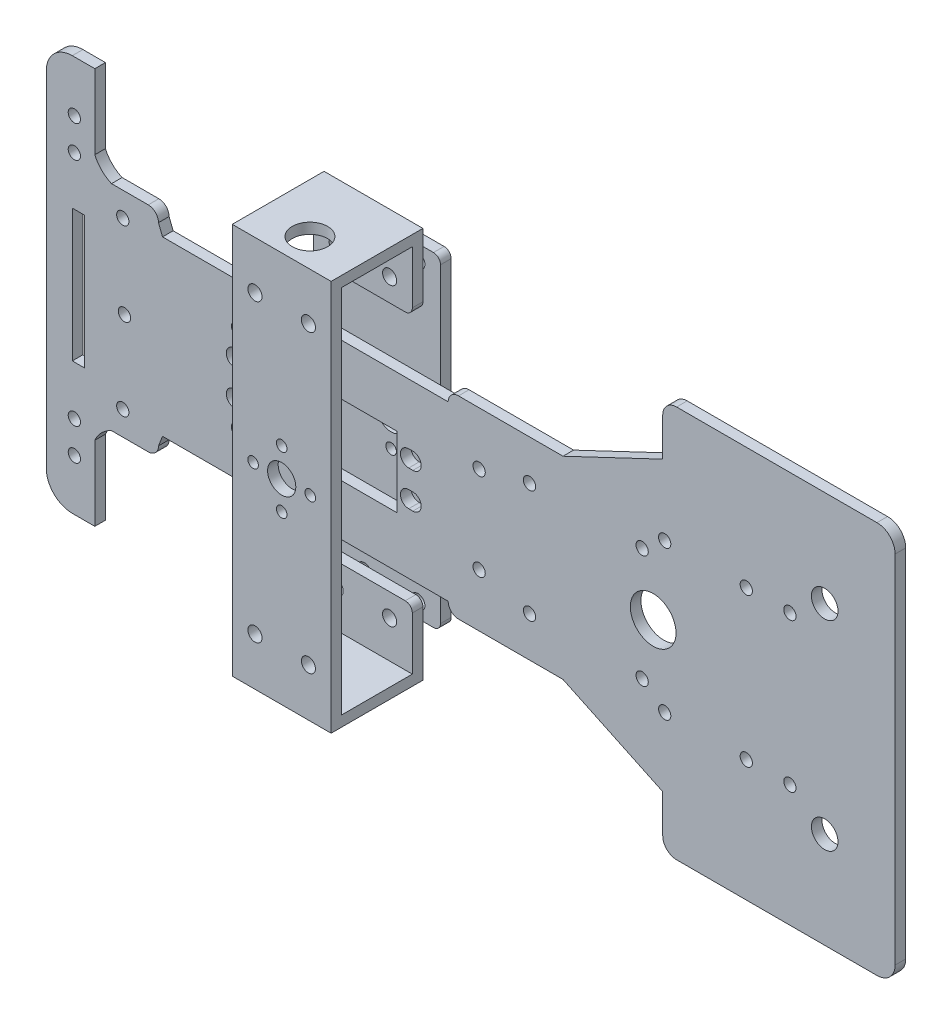
from build123d import *

# Parameters (mm, degrees)
CROQUIS2_R              = 1.737
CROQUIS2_R_2            = 6.474679508
CROQUIS2_R_3            = 1.75
CROQUIS2_R_4            = 3.766613255
CROQUIS2_W              = 3.410440409
CROQUIS2_H              = 37.484878613
SALIENTE_EXTRUIR1_DEPTH = 3
CROQUIS5_W              = 28
CROQUIS5_H              = 110.848883777
CROQUIS5_R              = 2
CROQUIS5_R_2            = 1.5
CROQUIS5_R_3            = 4
SALIENTE_EXTRUIR2_DEPTH = 3
CROQUIS8_W              = 28
CROQUIS8_H              = 3
SALIENTE_EXTRUIR3_DEPTH = 20
CROQUIS9_W              = 28
CROQUIS9_H              = 20
CROQUIS9_R              = 2
SALIENTE_EXTRUIR4_DEPTH = 3
CROQUIS11_W             = 28
CROQUIS11_H             = 92
CROQUIS11_R             = 2
CROQUIS11_R_2           = 4
CROQUIS11_R_3           = 1.5
SALIENTE_EXTRUIR5_DEPTH = 3
REDONDEO1_R             = 2
REDONDEO2_R             = 2
CROQUIS14_R             = 5
CORTAR_EXTRUIR1_DEPTH   = 143


with BuildPart() as part:
    # Croquis2 → Saliente-Extruir1 (new body)
    with BuildSketch(Plane.XY):
        with BuildLine():
            Line((135.637006617, 140.883623312), (142.01615233, 140.883623312))
            Line((142.01615233, 140.883623312), (142.01615233, 162.000573595))
            ThreePointArc((142.01615233, 162.000573595), (143.931876639, 164.810273756), (146.7415768, 166.725998065))
            Line((146.7415768, 166.725998065), (157.149961252, 166.725998065))
            ThreePointArc((157.149961252, 166.725998065), (159.207212475, 167.582059418), (160.049881153, 169.644832585))
            Line((160.049881153, 169.644832585), (161.200256838, 172.563544535))
            Line((161.200256838, 172.563544535), (242.107132368, 172.563544535))
            ThreePointArc((242.107132368, 172.563544535), (242.962021256, 170.499660188), (245.025905603, 169.6447713))
            Line((245.025905603, 169.6447713), (274.636700881, 169.6447713))
            Line((274.636700881, 169.6447713), (302.883038873, 156.245715556))
            Line((302.883038873, 156.245715556), (302.883038873, 145.415373876))
            ThreePointArc((302.883038873, 145.415373876), (304.035024246, 142.634235165), (306.816162957, 141.482249792))
            Line((306.816162957, 141.482249792), (363.555254762, 141.482249792))
            ThreePointArc((363.555254762, 141.482249792), (367.198292756, 142.9693816), (368.710342921, 146.602147921))
            Line((368.710342921, 146.602147921), (368.710342921, 247.445499159))
            ThreePointArc((368.710342921, 247.445499159), (367.198292756, 251.07826548), (363.555254762, 252.565397288))
            Line((363.555254762, 252.565397288), (306.816162957, 252.565397288))
            ThreePointArc((306.816162957, 252.565397288), (304.035024246, 251.413411916), (302.883038873, 248.632273205))
            Line((302.883038873, 248.632273205), (302.883038873, 237.801931524))
            Line((302.883038873, 237.801931524), (274.636700881, 224.402875781))
            Line((274.636700881, 224.402875781), (245.025905603, 224.402875781))
            ThreePointArc((245.025905603, 224.402875781), (242.962021256, 223.547986893), (242.107132368, 221.484102546))
            Line((242.107132368, 221.484102546), (161.200256838, 221.484102546))
            Line((161.200256838, 221.484102546), (160.049881153, 224.402814495))
            ThreePointArc((160.049881153, 224.402814495), (159.207212475, 226.465587662), (157.149961252, 227.321649016))
            Line((157.149961252, 227.321649016), (146.7415768, 227.321649016))
            ThreePointArc((146.7415768, 227.321649016), (143.931876639, 229.237373325), (142.01615233, 232.047073485))
            Line((142.01615233, 232.047073485), (142.01615233, 253.164023769))
            Line((142.01615233, 253.164023769), (135.637006617, 253.164023769))
            ThreePointArc((135.637006617, 253.164023769), (130.426405841, 251.005722259), (128.268104332, 245.795121484))
            Line((128.268104332, 245.795121484), (128.268104332, 148.252525597))
            ThreePointArc((128.268104332, 148.252525597), (130.426405841, 143.041924821), (135.637006617, 140.883623312))
        make_face()
        with Locations((136.215052653, 164.393067533)):
            Circle(CROQUIS2_R, mode=Mode.SUBTRACT)
        with Locations((136.215052653, 155.358437852)):
            Circle(CROQUIS2_R, mode=Mode.SUBTRACT)
        with Locations((149.928329849, 173.589029888)):
            Circle(CROQUIS2_R, mode=Mode.SUBTRACT)
        with Locations((182.434790984, 184.674109598)):
            Circle(CROQUIS2_R, mode=Mode.SUBTRACT)
        with Locations((250.875860992, 184.674109598)):
            Circle(CROQUIS2_R, mode=Mode.SUBTRACT)
        with Locations((265.148676133, 181.032013917)):
            Circle(CROQUIS2_R, mode=Mode.SUBTRACT)
        with Locations((297.051795115, 181.032013917)):
            Circle(CROQUIS2_R, mode=Mode.SUBTRACT)
        with Locations((303.441737448, 175.948286728)):
            Circle(CROQUIS2_R, mode=Mode.SUBTRACT)
        with Locations((326.550008787, 175.948286728)):
            Circle(CROQUIS2_R, mode=Mode.SUBTRACT)
        with Locations((338.901523724, 175.948286728)):
            Circle(CROQUIS2_R, mode=Mode.SUBTRACT)
        with Locations(Location((338.901523724, 218.099360352, 0), (0, 0, 180))):
            Circle(CROQUIS2_R, mode=Mode.SUBTRACT)
        with Locations(Location((326.550008787, 218.099360352, 0), (0, 0, 180))):
            Circle(CROQUIS2_R, mode=Mode.SUBTRACT)
        with Locations(Location((303.441737448, 218.099360352, 0), (0, 0, 180))):
            Circle(CROQUIS2_R, mode=Mode.SUBTRACT)
        with Locations(Location((297.051795115, 213.015633164, 0), (0, 0, 180))):
            Circle(CROQUIS2_R, mode=Mode.SUBTRACT)
        with Locations(Location((265.148676133, 213.015633164, 0), (0, 0, 180))):
            Circle(CROQUIS2_R, mode=Mode.SUBTRACT)
        with Locations(Location((250.875860992, 209.373537482, 0), (0, 0, 180))):
            Circle(CROQUIS2_R, mode=Mode.SUBTRACT)
        with Locations(Location((182.434790984, 209.373537482, 0), (0, 0, 180))):
            Circle(CROQUIS2_R, mode=Mode.SUBTRACT)
        with Locations(Location((149.928329849, 220.458617193, 0), (0, 0, 180))):
            Circle(CROQUIS2_R, mode=Mode.SUBTRACT)
        with Locations(Location((136.215052653, 238.689209229, 0), (0, 0, 180))):
            Circle(CROQUIS2_R, mode=Mode.SUBTRACT)
        with Locations(Location((136.215052653, 229.654579547, 0), (0, 0, 180))):
            Circle(CROQUIS2_R, mode=Mode.SUBTRACT)
        with Locations((300.175367567, 197.02382354)):
            Circle(CROQUIS2_R_2, mode=Mode.SUBTRACT)
        with Locations((150.399844764, 197.02382354)):
            Circle(CROQUIS2_R_3, mode=Mode.SUBTRACT)
        with Locations((348.762469348, 168.738884611)):
            Circle(CROQUIS2_R_4, mode=Mode.SUBTRACT)
        with Locations(Location((348.762469348, 225.30876247, 0), (0, 0, 180))):
            Circle(CROQUIS2_R_4, mode=Mode.SUBTRACT)
        with Locations((137.342226821, 197.023823541)):
            Rectangle(CROQUIS2_W, CROQUIS2_H, mode=Mode.SUBTRACT)
        Polygon((186.108331183, 187.02382354), (186.108331183, 207.02382354), (227.108331183, 207.02382354), (227.608331183, 207.02382354), (227.608331183, 187.02382354), align=None, mode=Mode.SUBTRACT)
        with BuildLine():
            Line((181.608331183, 204.378747893), (182.787568431, 204.378747893))
            ThreePointArc((182.787568431, 204.378747893), (185.142492784, 202.02382354), (182.787568431, 199.668899188))
            Line((182.787568431, 199.668899188), (181.608331183, 199.668899188))
            ThreePointArc((181.608331183, 199.668899188), (179.25340683, 202.02382354), (181.608331183, 204.378747893))
        make_face(mode=Mode.SUBTRACT)
        with BuildLine():
            Line((181.608331183, 189.668899188), (182.787568431, 189.668899188))
            ThreePointArc((182.787568431, 189.668899188), (185.142492784, 192.02382354), (182.787568431, 194.378747893))
            Line((182.787568431, 194.378747893), (181.608331183, 194.378747893))
            ThreePointArc((181.608331183, 194.378747893), (179.25340683, 192.02382354), (181.608331183, 189.668899188))
        make_face(mode=Mode.SUBTRACT)
        with BuildLine():
            Line((232.108331183, 189.668899188), (230.929093935, 189.668899188))
            ThreePointArc((230.929093935, 189.668899188), (228.574169582, 192.02382354), (230.929093935, 194.378747893))
            Line((230.929093935, 194.378747893), (232.108331183, 194.378747893))
            ThreePointArc((232.108331183, 194.378747893), (234.463255535, 192.02382354), (232.108331183, 189.668899188))
        make_face(mode=Mode.SUBTRACT)
        with BuildLine():
            Line((232.108331183, 204.378747893), (230.929093935, 204.378747893))
            ThreePointArc((230.929093935, 204.378747893), (228.574169582, 202.02382354), (230.929093935, 199.668899188))
            Line((230.929093935, 199.668899188), (232.108331183, 199.668899188))
            ThreePointArc((232.108331183, 199.668899188), (234.463255535, 202.02382354), (232.108331183, 204.378747893))
        make_face(mode=Mode.SUBTRACT)
    extrude(amount=SALIENTE_EXTRUIR1_DEPTH)


with BuildPart() as body_2:
    # Croquis5 → Saliente-Extruir2 (new body)
    with BuildSketch(Plane.XY.offset(18)):
        with Locations((212.947987222, 197.023823541)):
            Rectangle(CROQUIS5_W, CROQUIS5_H)
        with Locations((205.377900936, 155.173005863)):
            Circle(CROQUIS5_R, mode=Mode.SUBTRACT)
        with Locations(Location((220.518073507, 155.173005863, 0), (0, 0, 180))):
            Circle(CROQUIS5_R, mode=Mode.SUBTRACT)
        with Locations((220.518073507, 238.874641218)):
            Circle(CROQUIS5_R, mode=Mode.SUBTRACT)
        with Locations(Location((205.377900936, 238.874641218, 0), (0, 0, 180))):
            Circle(CROQUIS5_R, mode=Mode.SUBTRACT)
        with Locations((212.947987222, 205.12382354)):
            Circle(CROQUIS5_R_2, mode=Mode.SUBTRACT)
        with Locations((212.947987222, 188.92382354)):
            Circle(CROQUIS5_R_2, mode=Mode.SUBTRACT)
        with Locations((204.847987222, 197.02382354)):
            Circle(CROQUIS5_R_2, mode=Mode.SUBTRACT)
        with Locations((221.047987222, 197.02382354)):
            Circle(CROQUIS5_R_2, mode=Mode.SUBTRACT)
        with Locations((212.947987222, 197.02382354)):
            Circle(CROQUIS5_R_3, mode=Mode.SUBTRACT)
    extrude(amount=SALIENTE_EXTRUIR2_DEPTH)

    # Croquis8 → Saliente-Extruir3 (add)
    with BuildSketch(Plane(origin=(0, 0, 18), x_dir=(-1, 0, 0), z_dir=(0, 0, -1))):
        with Locations((-212.947987222, 143.099381652)):
            Rectangle(CROQUIS8_W, CROQUIS8_H)
        with Locations((-212.947987222, 250.948265429)):
            Rectangle(CROQUIS8_W, CROQUIS8_H)
    extrude(amount=SALIENTE_EXTRUIR3_DEPTH)

    # Croquis9 → Saliente-Extruir4 (add)
    # profile 1 of 2: a face of its own
    with BuildSketch(Plane(origin=(0, 0, -2), x_dir=(-1, 0, 0), z_dir=(0, 0, -1))):
        with Locations((-212.947987222, 151.599381652)):
            Rectangle(CROQUIS9_W, CROQUIS9_H)
        with Locations(Location((-205.377900936, 155.173005863, 0), (0, 0, 180))):
            Circle(CROQUIS9_R, mode=Mode.SUBTRACT)
        with Locations((-220.518073507, 155.173005863)):
            Circle(CROQUIS9_R, mode=Mode.SUBTRACT)
    # profile 2 of 2: a face of its own
    with BuildSketch(Plane(origin=(0, 0, -2), x_dir=(-1, 0, 0), z_dir=(0, 0, -1))):
        with Locations((-212.947987222, 242.448265429)):
            Rectangle(CROQUIS9_W, CROQUIS9_H)
        with Locations((-205.377900936, 238.874641218)):
            Circle(CROQUIS9_R, mode=Mode.SUBTRACT)
        with Locations(Location((-220.518073507, 238.874641218, 0), (0, 0, 180))):
            Circle(CROQUIS9_R, mode=Mode.SUBTRACT)
    extrude(amount=SALIENTE_EXTRUIR4_DEPTH)

    # Redondeo2
    redondeo2_edges = [body_2.edges().sort_by_distance(p)[0] for p in [
        (198.947987222, 161.599381652, -3.5),
        (226.947987222, 161.599381652, -3.5),
        (226.947987222, 232.448265429, -3.5),
        (198.947987222, 232.448265429, -3.5),
    ]]
    fillet(redondeo2_edges, radius=REDONDEO2_R)

    # Croquis14 → Cortar-Extruir1 (cut)
    with BuildSketch(Plane.XZ.offset(-141.599381652)):
        with Locations(Location((212.947987222, 13, 0), (0, 0, 270))):
            Circle(CROQUIS14_R)
    extrude(amount=-CORTAR_EXTRUIR1_DEPTH, mode=Mode.SUBTRACT)


with BuildPart() as body_3:
    # Croquis11 → Saliente-Extruir5 (new body)
    with BuildSketch(Plane(origin=(0, 0, -10), x_dir=(-1, 0, 0), z_dir=(0, 0, -1))):
        with Locations((-212.947987222, 197.02382354)):
            Rectangle(CROQUIS11_W, CROQUIS11_H)
        with Locations((-220.518073507, 238.874641218)):
            Circle(CROQUIS11_R, mode=Mode.SUBTRACT)
        with Locations((-205.377900936, 238.874641218)):
            Circle(CROQUIS11_R, mode=Mode.SUBTRACT)
        with Locations((-205.377900936, 155.173005863)):
            Circle(CROQUIS11_R, mode=Mode.SUBTRACT)
        with Locations((-220.518073507, 155.173005863)):
            Circle(CROQUIS11_R, mode=Mode.SUBTRACT)
        with Locations((-212.947987222, 197.02382354)):
            Circle(CROQUIS11_R_2, mode=Mode.SUBTRACT)
        with Locations((-204.847987222, 197.02382354)):
            Circle(CROQUIS11_R_3, mode=Mode.SUBTRACT)
        with Locations((-212.947987222, 205.12382354)):
            Circle(CROQUIS11_R_3, mode=Mode.SUBTRACT)
        with Locations((-212.947987222, 188.92382354)):
            Circle(CROQUIS11_R_3, mode=Mode.SUBTRACT)
        with Locations((-221.047987222, 197.02382354)):
            Circle(CROQUIS11_R_3, mode=Mode.SUBTRACT)
    extrude(amount=SALIENTE_EXTRUIR5_DEPTH)

    # Redondeo1
    redondeo1_edges = [body_3.edges().sort_by_distance(p)[0] for p in [
        (198.947987222, 151.02382354, -11.5),
        (226.947987222, 151.02382354, -11.5),
        (226.947987222, 243.02382354, -11.5),
        (198.947987222, 243.02382354, -11.5),
    ]]
    fillet(redondeo1_edges, radius=REDONDEO1_R)


solid = Compound([part.part, body_2.part, body_3.part])
